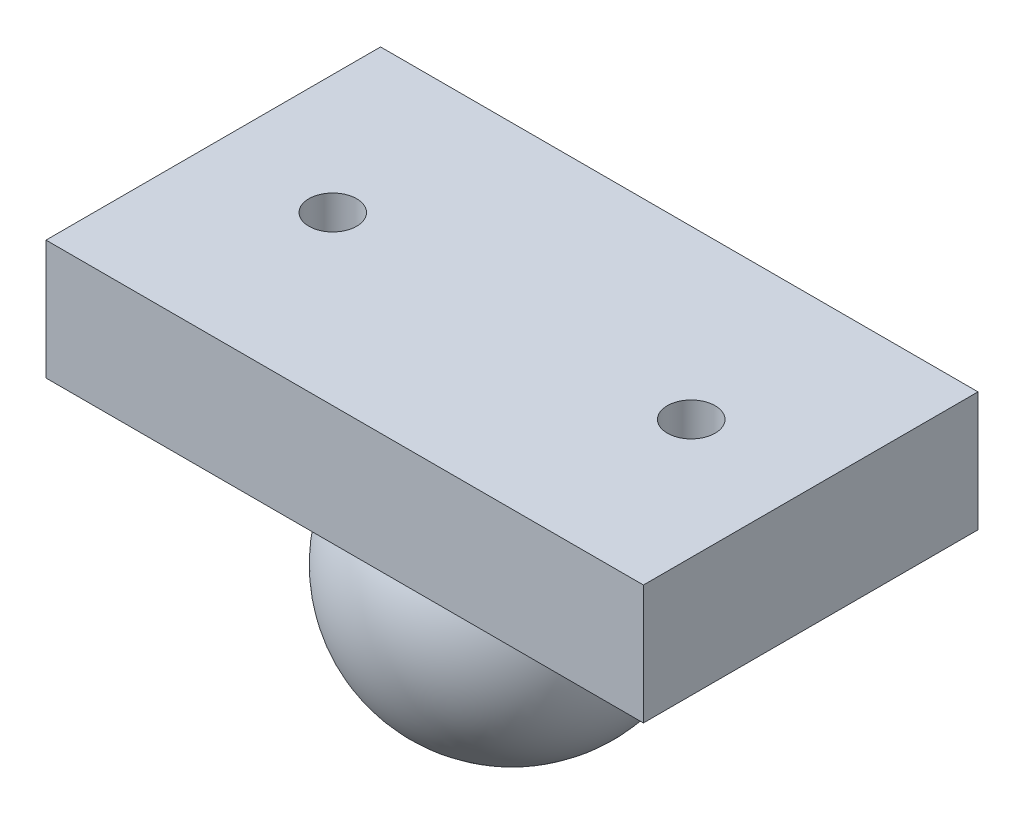
from build123d import *

# Parameters (mm, degrees)
SKETCH1_W           = 25
SKETCH1_H           = 14
SKETCH1_R           = 1
BOSS_EXTRUDE1_DEPTH = 5


with BuildPart() as part:
    # Sketch1 → Boss-Extrude1 (new body)
    with BuildSketch(Plane(origin=(0, 0, 0), x_dir=(1, 0, 0), z_dir=(0, 1, 0))):
        Rectangle(SKETCH1_W, SKETCH1_H)
        with Locations(Location((7.5, 0, 0), (0, 0, 270))):
            Circle(SKETCH1_R, mode=Mode.SUBTRACT)
        with Locations(Location((-7.5, 0, 0), (0, 0, 270))):
            Circle(SKETCH1_R, mode=Mode.SUBTRACT)
    extrude(amount=BOSS_EXTRUDE1_DEPTH)

    # Sketch2 → Revolve-Thin1 (revolve)
    with BuildSketch(Plane.XY):
        with BuildLine():
            ThreePointArc((0, -10), (-6, -4), (0, 2))
            Line((0, 2), (0, 1))
            ThreePointArc((0, 1), (-5, -4), (0, -9))
            Line((0, -9), (0, -10))
        make_face()
    revolve(axis=Axis((0, 2, 0), (0, -1, 0)))


solid = part.part
